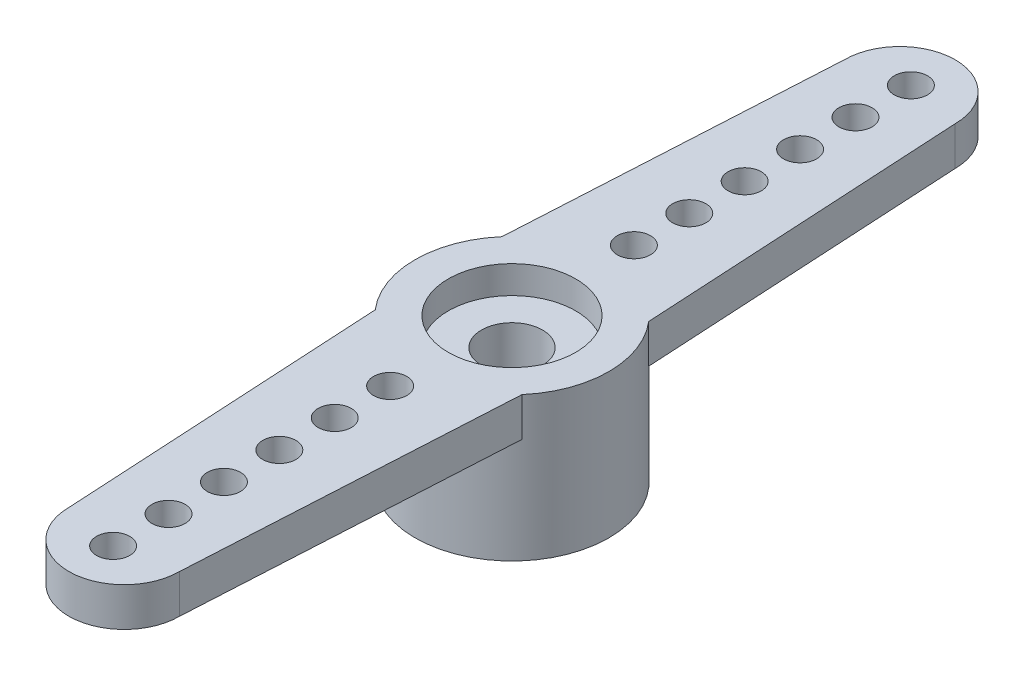
from build123d import *

# Parameters (mm, degrees)
SKETCH1_R           = 0.6
BOSS_EXTRUDE1_DEPTH = 1.4
SKETCH2_R           = 3.5
BOSS_EXTRUDE2_DEPTH = 3.8
SKETCH3_R           = 2.3
CUT_EXTRUDE1_DEPTH  = 1
SKETCH4_R           = 2.5
CUT_EXTRUDE2_DEPTH  = 2
CUT_EXTRUDE3_REACH  = 18.908
SKETCH5_R           = 1.102182138


with BuildPart() as part:
    # Sketch1 → Boss-Extrude1 (new body)
    with BuildSketch(Plane(origin=(0, 0, 0), x_dir=(1, 0, 0), z_dir=(0, 1, 0))):
        with BuildLine():
            ThreePointArc((2.65, 2.286372673), (3.5, 0), (2.65, -2.286372673))
            Line((2.65, -2.286372673), (2, -14))
            ThreePointArc((2, -14), (0, -16), (-2, -14))
            Line((-2, -14), (-2.65, -2.286372673))
            ThreePointArc((-2.65, -2.286372673), (-3.5, 0), (-2.65, 2.286372673))
            Line((-2.65, 2.286372673), (-2, 14))
            ThreePointArc((-2, 14), (0, 16), (2, 14))
            Line((2, 14), (2.65, 2.286372673))
        make_face()
        with Locations(Location((0, -12.4, 0), (0, 0, 270))):
            Circle(SKETCH1_R, mode=Mode.SUBTRACT)
        with Locations(Location((0, -8.4, 0), (0, 0, 270))):
            Circle(SKETCH1_R, mode=Mode.SUBTRACT)
        with Locations(Location((0, -4.4, 0), (0, 0, 270))):
            Circle(SKETCH1_R, mode=Mode.SUBTRACT)
        with Locations(Location((0, 4.4, 0), (0, 0, 270))):
            Circle(SKETCH1_R, mode=Mode.SUBTRACT)
        with Locations(Location((0, 6.4, 0), (0, 0, 270))):
            Circle(SKETCH1_R, mode=Mode.SUBTRACT)
        with Locations(Location((0, 8.4, 0), (0, 0, 270))):
            Circle(SKETCH1_R, mode=Mode.SUBTRACT)
        with Locations(Location((0, 10.4, 0), (0, 0, 270))):
            Circle(SKETCH1_R, mode=Mode.SUBTRACT)
        with Locations(Location((0, 12.4, 0), (0, 0, 270))):
            Circle(SKETCH1_R, mode=Mode.SUBTRACT)
        with Locations(Location((0, 14.4, 0), (0, 0, 270))):
            Circle(SKETCH1_R, mode=Mode.SUBTRACT)
        with Locations(Location((0, -6.4, 0), (0, 0, 270))):
            Circle(SKETCH1_R, mode=Mode.SUBTRACT)
        with Locations(Location((0, -10.4, 0), (0, 0, 270))):
            Circle(SKETCH1_R, mode=Mode.SUBTRACT)
        with Locations(Location((0, -14.4, 0), (0, 0, 270))):
            Circle(SKETCH1_R, mode=Mode.SUBTRACT)
    extrude(amount=-BOSS_EXTRUDE1_DEPTH)

    # Sketch2 → Boss-Extrude2 (add)
    with BuildSketch(Plane(origin=(0, -1.4, 0), x_dir=(-1, 0, 0), z_dir=(0, -1, 0))):
        with Locations(Location((0, 0, 0), (0, 0, 319.212961807))):
            Circle(SKETCH2_R)
    extrude(amount=BOSS_EXTRUDE2_DEPTH)

    # Sketch3 → Cut-Extrude1 (cut)
    with BuildSketch(Plane(origin=(0, 0, 0), x_dir=(1, 0, 0), z_dir=(0, 1, 0))):
        with Locations(Location((0, 0, 0), (0, 0, 270))):
            Circle(SKETCH3_R)
    extrude(amount=-CUT_EXTRUDE1_DEPTH, mode=Mode.SUBTRACT)

    # Sketch4 → Cut-Extrude2 (cut)
    with BuildSketch(Plane(origin=(0, -5.2, 0), x_dir=(-1, 0, 0), z_dir=(0, -1, 0))):
        with Locations(Location((0, 0, 0), (0, 0, 90))):
            Circle(SKETCH4_R)
    extrude(amount=-CUT_EXTRUDE2_DEPTH, mode=Mode.SUBTRACT)

    # Sketch5 → Cut-Extrude3 (cut, up to next)
    with BuildSketch(Plane(origin=(0, -1, 0), x_dir=(1, 0, 0), z_dir=(0, 1, 0)), mode=Mode.PRIVATE) as cut_extrude3_sk1:
        with Locations(Location((0, 0, 0), (0, 0, 270))):
            Circle(SKETCH5_R)
    cut_extrude3_tool1 = extrude(cut_extrude3_sk1.sketch, amount=-CUT_EXTRUDE3_REACH, mode=Mode.PRIVATE) & part.part
    add(cut_extrude3_tool1.solids().sort_by_distance((0, -1, 0))[0], mode=Mode.SUBTRACT)


solid = part.part
